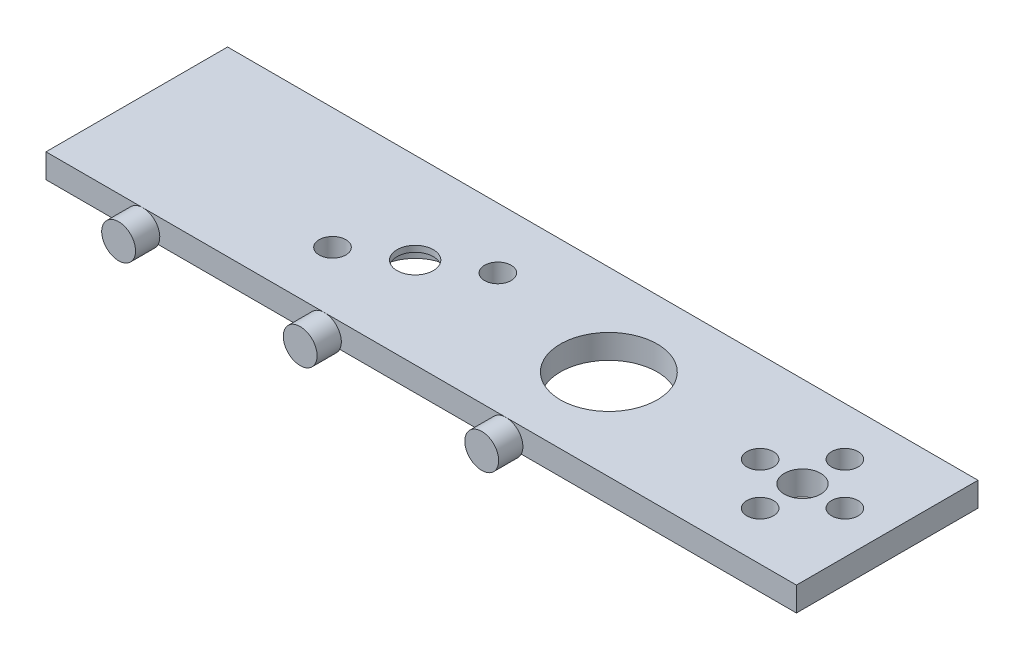
from build123d import *

# Parameters (mm, degrees)
SKETCH_1_W          = 62
SKETCH_1_H          = 15
SKETCH_1_R          = 1.5
SKETCH_1_R_2        = 1.1
SKETCH_1_R_3        = 4
EXTRUDE_1_DEPTH     = 2
SKETCH_2_R          = 1.4
EXTRUDE_2_DEPTH     = 2
SKETCH_3_R          = 3
CUT_EXTRUDE_1_DEPTH = 1.5


with BuildPart() as part:
    # 草图1 → 凸台-拉伸1 (new body)
    with BuildSketch(Plane(origin=(0, 0, 0), x_dir=(1, 0, 0), z_dir=(0, 1, 0))):
        Rectangle(SKETCH_1_W, SKETCH_1_H)
        with Locations(Location((-8, 0, 0), (0, 0, 270))):
            Circle(SKETCH_1_R, mode=Mode.SUBTRACT)
        with Locations(Location((-3.669872981, 2.5, 0), (0, 0, 270))):
            Circle(SKETCH_1_R_2, mode=Mode.SUBTRACT)
        with Locations(Location((-12.330127019, -2.5, 0), (0, 0, 270))):
            Circle(SKETCH_1_R_2, mode=Mode.SUBTRACT)
        with Locations(Location((8, 0, 0), (0, 0, 270))):
            Circle(SKETCH_1_R_3, mode=Mode.SUBTRACT)
        with Locations(Location((24, 0, 0), (0, 0, 270))):
            Circle(SKETCH_1_R, mode=Mode.SUBTRACT)
        with Locations(Location((27.5, 0, 0), (0, 0, 270))):
            Circle(SKETCH_1_R_2, mode=Mode.SUBTRACT)
        with Locations(Location((24, -3.5, 0), (0, 0, 270))):
            Circle(SKETCH_1_R_2, mode=Mode.SUBTRACT)
        with Locations(Location((20.5, 0, 0), (0, 0, 270))):
            Circle(SKETCH_1_R_2, mode=Mode.SUBTRACT)
        with Locations(Location((24, 3.5, 0), (0, 0, 270))):
            Circle(SKETCH_1_R_2, mode=Mode.SUBTRACT)
    extrude(amount=EXTRUDE_1_DEPTH)

    # 草图2 → 凸台-拉伸2 (add)
    with BuildSketch(Plane.XY.offset(7.5)):
        with Locations(Location((-23, 0.6, 0), (0, 0, 205.376933525))):
            Circle(SKETCH_2_R)
        with Locations(Location((-8, 0.6, 0), (0, 0, 205.376933525))):
            Circle(SKETCH_2_R)
        with Locations(Location((7, 0.6, 0), (0, 0, 205.376933525))):
            Circle(SKETCH_2_R)
    extrude(amount=EXTRUDE_2_DEPTH)

    # 草图3 → 切除-拉伸1 (cut)
    with BuildSketch(Plane.XZ):
        with Locations(Location((-8, 0, 0), (0, 0, 270))):
            Circle(SKETCH_3_R)
    extrude(amount=-CUT_EXTRUDE_1_DEPTH, mode=Mode.SUBTRACT)


solid = part.part
